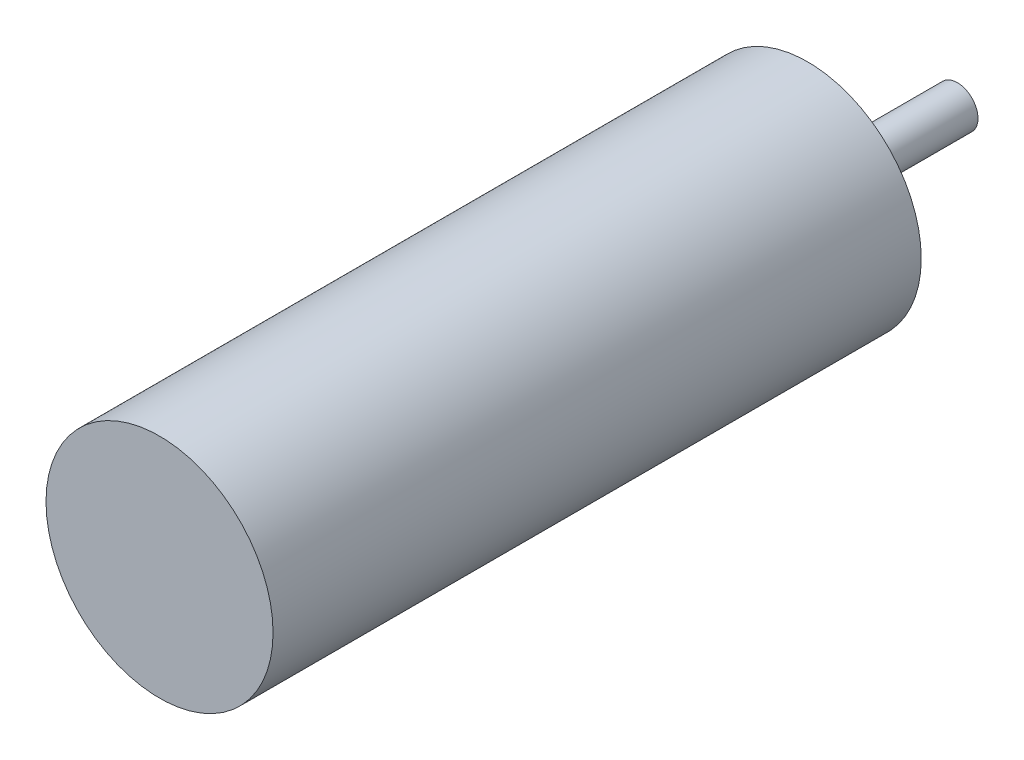
from build123d import *

# Parameters (mm, degrees)
SKETCH2_R          = 1
CUT_EXTRUDE1_DEPTH = 3


with BuildPart() as part:
    # Sketch1 → Revolve1 (revolve)
    with BuildSketch(Plane(origin=(0, 0, 0), x_dir=(1, 0, 0), z_dir=(0, 1, 0))):
        Polygon((0, 0), (11, 0), (11, 62.8), (7, 62.8), (7, 65.3), (2, 65.3), (2, 77.3), (0, 77.3), align=None)
    revolve(axis=Axis((0, 0, 0), (0, 0, -1)))

    # Sketch2 → Cut-Extrude1 (cut)
    with BuildSketch(Plane(origin=(0, 0, -62.8), x_dir=(-1, 0, 0), z_dir=(0, 0, -1))):
        with Locations((-8, -4.618802154)):
            Circle(SKETCH2_R)
        with Locations((0, 9.237604307)):
            Circle(SKETCH2_R)
        with Locations((8, -4.618802154)):
            Circle(SKETCH2_R)
    extrude(amount=-CUT_EXTRUDE1_DEPTH, mode=Mode.SUBTRACT)


solid = part.part
